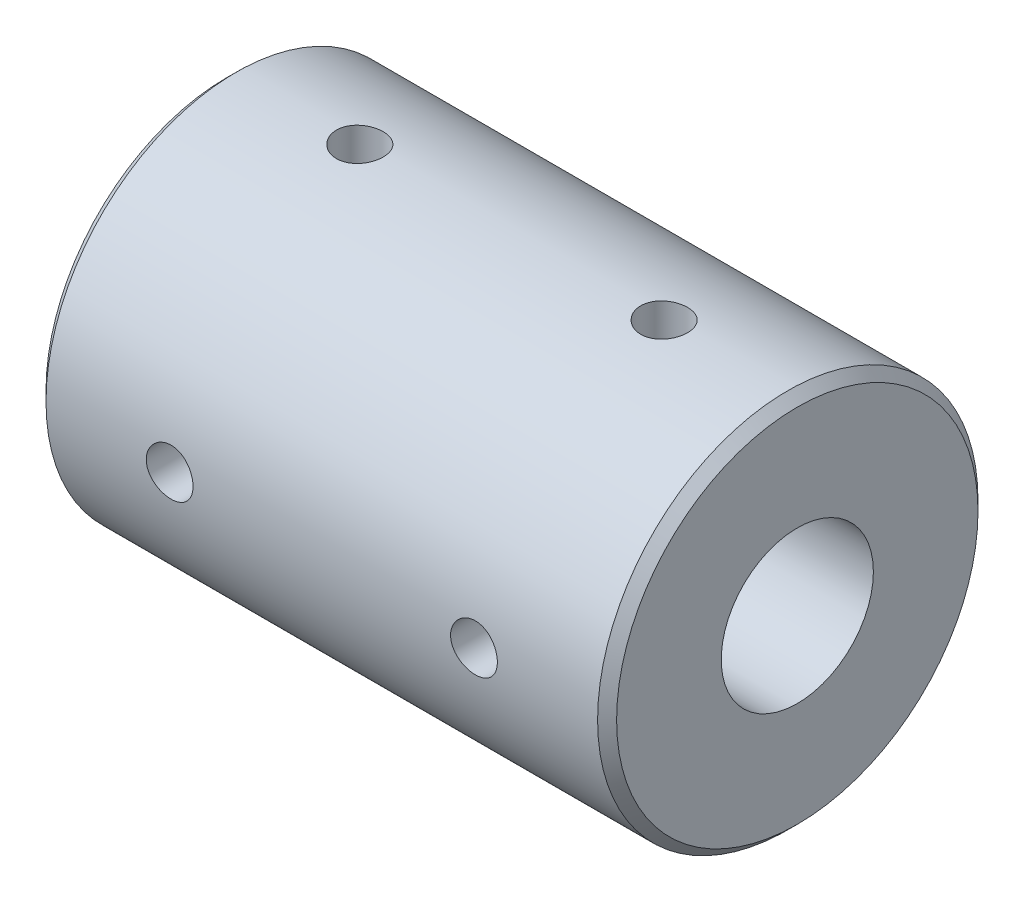
from build123d import *

# Parameters (mm, degrees)
SKETCH1_W          = 30
SKETCH1_H          = 10
SKETCH2_R          = 2.5
CUT_EXTRUDE1_DEPTH = 15
SKETCH3_R          = 4
CUT_EXTRUDE2_DEPTH = 15
TAP1_REACH         = 39.417
TAP1_BORE_R        = 1.2295
TAP2_REACH         = 39.417
TAP2_BORE_R        = 1.2295
CHAMFER1_SIZE      = 0.5


with BuildPart() as part:
    # Sketch1 → Revolve1 (revolve)
    with BuildSketch(Plane.XY, mode=Mode.PRIVATE) as revolve1_sk:
        with Locations((15, 5)):
            Rectangle(SKETCH1_W, SKETCH1_H)
    revolve(revolve1_sk.sketch.rotate(Axis((0, 0, 0), (1, 0, 0)), 90), axis=Axis((0, 0, 0), (1, 0, 0)))

    # Sketch2 → Cut-Extrude1 (cut)
    with BuildSketch(Plane(origin=(0, 0, 0), x_dir=(0, 0, -1), z_dir=(1, 0, 0))):
        Circle(SKETCH2_R)
    extrude(amount=CUT_EXTRUDE1_DEPTH, mode=Mode.SUBTRACT)

    # Sketch3 → Cut-Extrude2 (cut)
    with BuildSketch(Plane(origin=(30, 0, 0), x_dir=(0, 0, -1), z_dir=(1, 0, 0))):
        Circle(SKETCH3_R)
    extrude(amount=-CUT_EXTRUDE2_DEPTH, mode=Mode.SUBTRACT)

    # Tap1 bore → Tap1 (cut, up to next)
    with BuildSketch(Plane.XY.offset(10), mode=Mode.PRIVATE) as tap1_sk1:
        with Locations((7, 0)):
            Circle(TAP1_BORE_R)
    tap1_tool1 = extrude(tap1_sk1.sketch, amount=-TAP1_REACH, mode=Mode.PRIVATE) & part.part
    # Tap1 bore → Tap1 (cut, up to next)
    with BuildSketch(Plane.XY.offset(10), mode=Mode.PRIVATE) as tap1_sk2:
        with Locations((23, 0)):
            Circle(TAP1_BORE_R)
    tap1_tool2 = extrude(tap1_sk2.sketch, amount=-TAP1_REACH, mode=Mode.PRIVATE) & part.part
    add(tap1_tool1.solids().sort_by_distance((7, 0, 10))[0], mode=Mode.SUBTRACT)
    add(tap1_tool2.solids().sort_by_distance((23, 0, 10))[0], mode=Mode.SUBTRACT)

    # Tap2 bore → Tap2 (cut, up to next)
    with BuildSketch(Plane(origin=(0, 10, 0), x_dir=(1, 0, 0), z_dir=(0, 1, 0)), mode=Mode.PRIVATE) as tap2_sk1:
        with Locations((7, 0)):
            Circle(TAP2_BORE_R)
    tap2_tool1 = extrude(tap2_sk1.sketch, amount=-TAP2_REACH, mode=Mode.PRIVATE) & part.part
    # Tap2 bore → Tap2 (cut, up to next)
    with BuildSketch(Plane(origin=(0, 10, 0), x_dir=(1, 0, 0), z_dir=(0, 1, 0)), mode=Mode.PRIVATE) as tap2_sk2:
        with Locations((23, 0)):
            Circle(TAP2_BORE_R)
    tap2_tool2 = extrude(tap2_sk2.sketch, amount=-TAP2_REACH, mode=Mode.PRIVATE) & part.part
    add(tap2_tool1.solids().sort_by_distance((7, 10, 0))[0], mode=Mode.SUBTRACT)
    add(tap2_tool2.solids().sort_by_distance((23, 10, 0))[0], mode=Mode.SUBTRACT)

    # Chamfer1
    chamfer1_edges = [part.edges().sort_by_distance(p)[0] for p in [
        (30, 0, -10),
        (0, 0, -10),
    ]]
    chamfer(chamfer1_edges, length=CHAMFER1_SIZE)


solid = part.part
